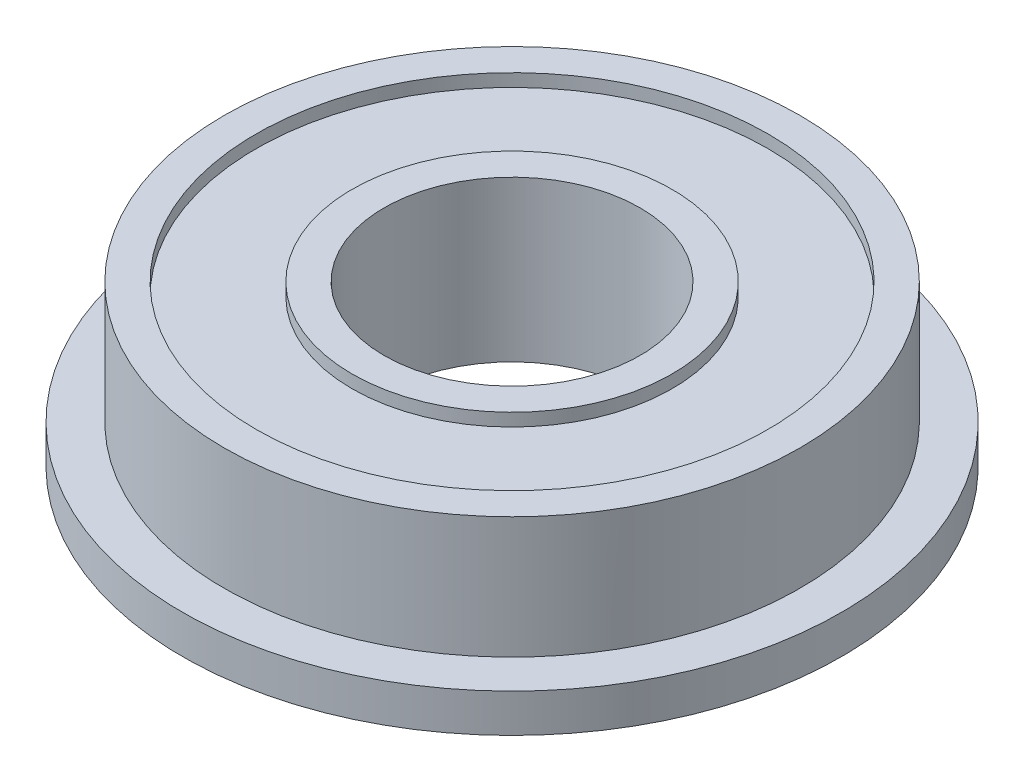
from build123d import *

# Parameters (mm, degrees)
SKETCH_1_R          = 4.5
SKETCH_1_R_2        = 2
EXTRUDE_1_DEPTH     = 2.5
SKETCH_2_R          = 5.15
SKETCH_2_R_2        = 2
EXTRUDE_2_DEPTH     = 0.6
SKETCH_4_R          = 4
SKETCH_4_R_2        = 2.5
CUT_EXTRUDE_1_DEPTH = 0.2


with BuildPart() as part:
    # 草图1 → 凸台-拉伸1 (new body)
    with BuildSketch(Plane(origin=(0, 0, 0), x_dir=(1, 0, 0), z_dir=(0, 1, 0))):
        with Locations(Location((0, 0, 0), (0, 0, 270))):
            Circle(SKETCH_1_R)
        with Locations(Location((0, 0, 0), (0, 0, 270))):
            Circle(SKETCH_1_R_2, mode=Mode.SUBTRACT)
    extrude(amount=EXTRUDE_1_DEPTH)

    # 草图2 → 凸台-拉伸2 (add)
    with BuildSketch(Plane.XZ):
        with Locations(Location((0, 0, 0), (0, 0, 270))):
            Circle(SKETCH_2_R)
        with Locations(Location((0, 0, 0), (0, 0, 90))):
            Circle(SKETCH_2_R_2, mode=Mode.SUBTRACT)
    extrude(amount=-EXTRUDE_2_DEPTH)

    # 草图4 → 切除-拉伸1 (cut)
    with BuildSketch(Plane(origin=(0, 2.5, 0), x_dir=(1, 0, 0), z_dir=(0, 1, 0))):
        with Locations(Location((0, 0, 0), (0, 0, 270))):
            Circle(SKETCH_4_R)
        with Locations(Location((0, 0, 0), (0, 0, 270))):
            Circle(SKETCH_4_R_2, mode=Mode.SUBTRACT)
    cut_extrude_1 = extrude(amount=-CUT_EXTRUDE_1_DEPTH, mode=Mode.SUBTRACT)

    # 镜向1: 切除-拉伸1 across plane
    add(cut_extrude_1.mirror(Plane(origin=(0, 1.25, 0), x_dir=(0, 0, 1), z_dir=(0, -1, 0))), mode=Mode.SUBTRACT)


solid = part.part
